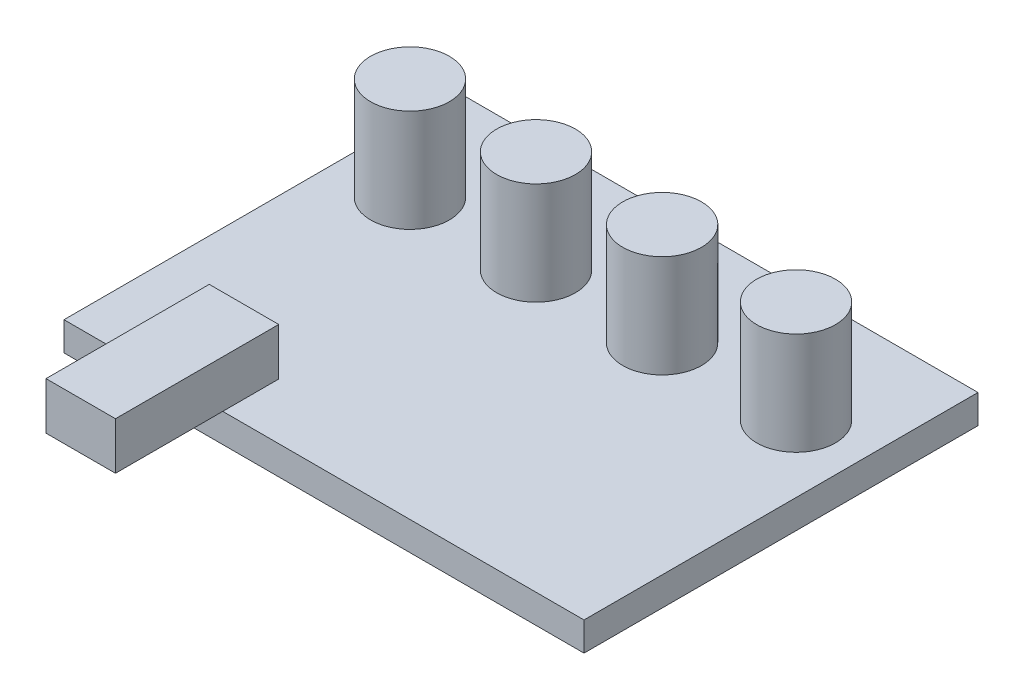
from build123d import *

# Parameters (mm, degrees)
SKETCH1_W           = 65.997826612
SKETCH1_H           = 50
BOSS_EXTRUDE1_DEPTH = 3.65
SKETCH2_R           = 5
BOSS_EXTRUDE2_DEPTH = 13
SKETCH3_W           = 8.816306995
SKETCH3_H           = 20.718287769
BOSS_EXTRUDE3_DEPTH = 6


with BuildPart() as part:
    # Sketch1 → Boss-Extrude1 (new body)
    with BuildSketch(Plane(origin=(0, 0, 0), x_dir=(1, 0, 0), z_dir=(0, 1, 0))):
        with Locations((0, -0.7)):
            Rectangle(SKETCH1_W, SKETCH1_H)
    extrude(amount=BOSS_EXTRUDE1_DEPTH)

    # Sketch2 → Boss-Extrude2 (add)
    with BuildSketch(Plane(origin=(0, 3.65, 0), x_dir=(1, 0, 0), z_dir=(0, 1, 0))):
        with Locations(Location((-24.5, 9.711573264, 0), (0, 0, 90))):
            Circle(SKETCH2_R)
        with Locations(Location((-8.5, 9.711573264, 0), (0, 0, 90))):
            Circle(SKETCH2_R)
        with Locations(Location((7.5, 9.711573264, 0), (0, 0, 90))):
            Circle(SKETCH2_R)
        with Locations(Location((24.5, 9.711573264, 0), (0, 0, 90))):
            Circle(SKETCH2_R)
    extrude(amount=BOSS_EXTRUDE2_DEPTH)

    # Sketch3 → Boss-Extrude3 (add)
    with BuildSketch(Plane(origin=(0, 3.65, 0), x_dir=(1, 0, 0), z_dir=(0, 1, 0))):
        with Locations((-17.257821891, -28.955694161)):
            Rectangle(SKETCH3_W, SKETCH3_H)
    extrude(amount=BOSS_EXTRUDE3_DEPTH)


solid = part.part
